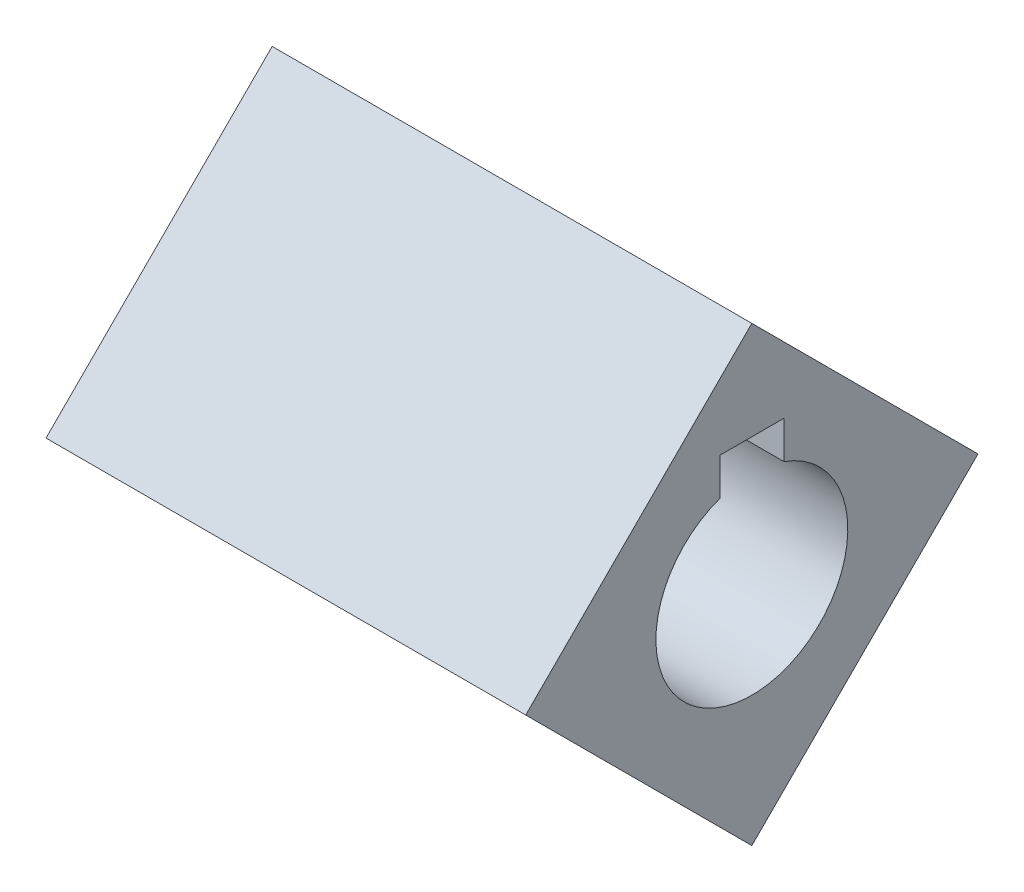
from build123d import *

# Parameters (mm, degrees)
SKETCH1_W          = 30
SKETCH1_H          = 17.5
SKETCH5_R          = 6
CUT_EXTRUDE3_DEPTH = 39.890872965
SKETCH6_W          = 4
SKETCH6_H          = 4
CUT_EXTRUDE5_DEPTH = 39.890872965
SKETCH7_OUTSIDE_W  = 48.576
SKETCH7_OUTSIDE_H  = 48.576
CUT_EXTRUDE6_DEPTH = 39.890872965


with BuildPart() as part:
    # Sketch1 → Revolve1 (revolve)
    with BuildSketch(Plane.XY, mode=Mode.PRIVATE) as revolve1_sk:
        with Locations((15, 8.75)):
            Rectangle(SKETCH1_W, SKETCH1_H)
    revolve(revolve1_sk.sketch.rotate(Axis((0, 0, 0), (-1, 0, 0)), 90), axis=Axis((0, 0, 0), (-1, 0, 0)))

    # Sketch5 → Cut-Extrude3 (cut, through all)
    with BuildSketch(Plane.ZY):
        Circle(SKETCH5_R)
    extrude(amount=-CUT_EXTRUDE3_DEPTH, mode=Mode.SUBTRACT)

    # Sketch6 → Cut-Extrude5 (cut, through all)
    with BuildSketch(Plane.ZY):
        with Locations((0, 6)):
            Rectangle(SKETCH6_W, SKETCH6_H)
    extrude(amount=-CUT_EXTRUDE5_DEPTH, mode=Mode.SUBTRACT)

    # Sketch7 outside → Cut-Extrude6 (cut, through all)
    with BuildSketch(Plane(origin=(30, 0, 0), x_dir=(0, 0, -1), z_dir=(1, 0, 0))):
        Rectangle(SKETCH7_OUTSIDE_W, SKETCH7_OUTSIDE_H)
        Polygon((-14.142135624, 0), (0, -14.142135624), (14.142135624, 0), (0, 14.142135624), align=None, mode=Mode.SUBTRACT)
    extrude(amount=-CUT_EXTRUDE6_DEPTH, mode=Mode.SUBTRACT)


solid = part.part
